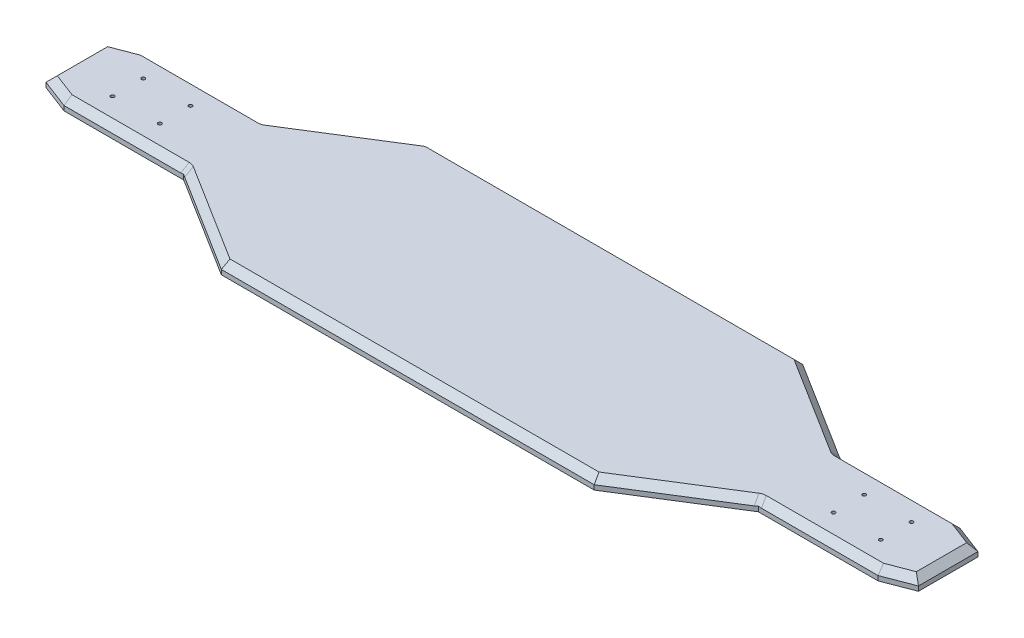
from build123d import *

# Parameters (mm, degrees)
BOSS_EXTRUDE1_DEPTH = 15.24
CHAMFER1_SIZE       = 9
FILLET1_R           = 20
SKETCH2_R           = 2.38125
CUT_EXTRUDE1_DEPTH  = 15.24


with BuildPart() as part:
    # Sketch1 → Boss-Extrude1 (new body)
    with BuildSketch(Plane(origin=(0, 0, 0), x_dir=(1, 0, 0), z_dir=(0, 1, 0))):
        Polygon((-365.243004426, 189.912666736), (135.648161339, 189.912666736), (271.202578456, 104.912666736), (431.972487964, 104.912666736), (471.202578456, 89.912666736), (471.202578456, 9.912666736), (431.972487964, -5.087333264), (271.202578456, -5.087333264), (135.648161339, -90.087333264), (-365.243004426, -90.087333264), (-500.797421544, -5.087333264), (-661.567331052, -5.087333264), (-700.797421544, 9.912666736), (-700.797421544, 89.912666736), (-661.567331052, 104.912666736), (-500.797421544, 104.912666736), align=None)
    extrude(amount=BOSS_EXTRUDE1_DEPTH)

    # Chamfer1
    chamfer1_edges = [part.edges().sort_by_distance(p)[0] for p in [
        (451.58753321, 15.24, -2.412666736),
        (471.202578456, 15.24, -49.912666736),
        (451.58753321, 15.24, -97.412666736),
        (351.58753321, 15.24, -104.912666736),
        (203.425369898, 15.24, -147.412666736),
        (-114.797421544, 15.24, -189.912666736),
        (-433.020212985, 15.24, -147.412666736),
        (-581.182376298, 15.24, -104.912666736),
        (-681.182376298, 15.24, -97.412666736),
        (-700.797421544, 15.24, -49.912666736),
        (203.425369898, 15.24, 47.587333264),
        (-681.182376298, 15.24, -2.412666736),
        (-581.182376298, 15.24, 5.087333264),
        (-433.020212985, 15.24, 47.587333264),
        (-114.797421544, 15.24, 90.087333264),
        (351.58753321, 15.24, 5.087333264),
    ]]
    chamfer(chamfer1_edges, length=CHAMFER1_SIZE)

    # Fillet1
    fillet1_edges = [part.edges().sort_by_distance(p)[0] for p in [
        (269.908400539, 10.74, 0.587333264),
        (-499.503243626, 10.74, 0.587333264),
        (269.908400539, 10.74, -100.412666736),
        (-499.503243626, 10.74, -100.412666736),
    ]]
    fillet(fillet1_edges, radius=FILLET1_R)

    # Sketch2 → Cut-Extrude1 (cut)
    with BuildSketch(Plane.XZ):
        with BuildLine():
            ThreePointArc((-628.416171544, -70.550166736), (-629.113623521, -68.866368714), (-630.797421544, -68.168916736))
            Line((-630.797421544, -68.168916736), (-630.797421544, -70.550166736))
            Line((-630.797421544, -70.550166736), (-628.416171544, -70.550166736))
        make_face()
        with BuildLine():
            Line((-630.797421544, -70.550166736), (-630.797421544, -68.168916736))
            ThreePointArc((-630.797421544, -68.168916736), (-632.481219566, -72.233964759), (-628.416171544, -70.550166736))
            Line((-628.416171544, -70.550166736), (-630.797421544, -70.550166736))
        make_face()
        with BuildLine():
            Line((-630.797421544, -31.656416736), (-630.797421544, -29.275166736))
            Line((-630.797421544, -29.275166736), (-628.416171544, -29.275166736))
            ThreePointArc((-628.416171544, -29.275166736), (-632.481219566, -27.591368714), (-630.797421544, -31.656416736))
        make_face()
        with BuildLine():
            Line((-628.416171544, -29.275166736), (-630.797421544, -29.275166736))
            Line((-630.797421544, -29.275166736), (-630.797421544, -31.656416736))
            ThreePointArc((-630.797421544, -31.656416736), (-629.113623521, -30.958964759), (-628.416171544, -29.275166736))
        make_face()
        with BuildLine():
            ThreePointArc((-564.916171544, -29.275166736), (-567.297421544, -26.893916736), (-569.678671544, -29.275166736))
            Line((-569.678671544, -29.275166736), (-567.297421544, -29.275166736))
            Line((-567.297421544, -29.275166736), (-567.297421544, -31.656416736))
            ThreePointArc((-567.297421544, -31.656416736), (-565.613623521, -30.958964759), (-564.916171544, -29.275166736))
        make_face()
        with BuildLine():
            Line((-567.297421544, -29.275166736), (-569.678671544, -29.275166736))
            ThreePointArc((-569.678671544, -29.275166736), (-568.981219566, -30.958964759), (-567.297421544, -31.656416736))
            Line((-567.297421544, -31.656416736), (-567.297421544, -29.275166736))
        make_face()
        with BuildLine():
            ThreePointArc((-564.916171544, -70.550166736), (-565.613623521, -68.866368714), (-567.297421544, -68.168916736))
            Line((-567.297421544, -68.168916736), (-567.297421544, -70.550166736))
            Line((-567.297421544, -70.550166736), (-569.678671544, -70.550166736))
            ThreePointArc((-569.678671544, -70.550166736), (-567.297421544, -72.931416736), (-564.916171544, -70.550166736))
        make_face()
        with BuildLine():
            Line((-567.297421544, -70.550166736), (-567.297421544, -68.168916736))
            ThreePointArc((-567.297421544, -68.168916736), (-568.981219566, -68.866368714), (-569.678671544, -70.550166736))
            Line((-569.678671544, -70.550166736), (-567.297421544, -70.550166736))
        make_face()
        with Locations(Location((337.702578456, -70.550166736, 0), (0, 0, 270))):
            Circle(SKETCH2_R)
        with Locations(Location((337.702578456, -29.275166736, 0), (0, 0, 270))):
            Circle(SKETCH2_R)
        with Locations(Location((401.202578456, -29.275166736, 0), (0, 0, 270))):
            Circle(SKETCH2_R)
        with Locations(Location((401.202578456, -70.550166736, 0), (0, 0, 270))):
            Circle(SKETCH2_R)
    extrude(amount=-CUT_EXTRUDE1_DEPTH, mode=Mode.SUBTRACT)


solid = part.part
